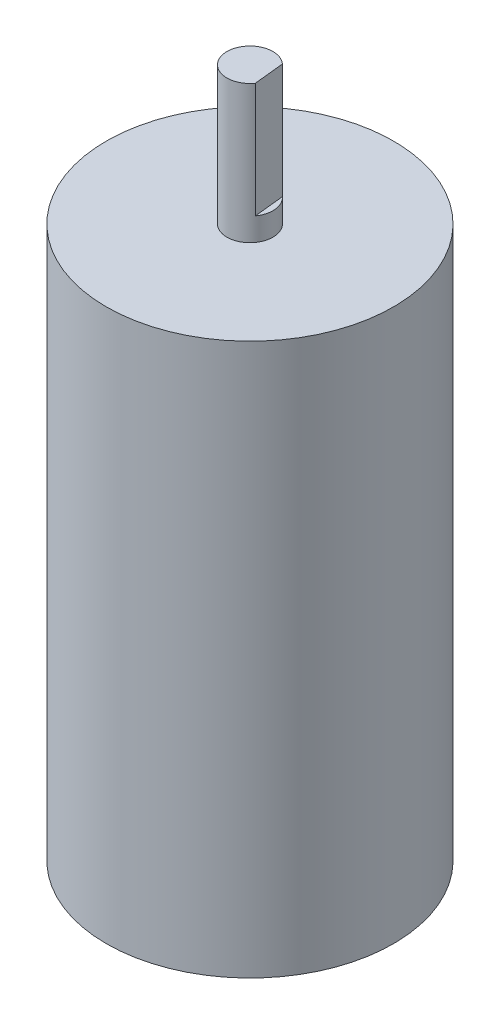
from build123d import *

# Parameters (mm, degrees)
SKETCH_1_R          = 12.5
EXTRUDE_1_DEPTH     = 48
SKETCH_2_R          = 2
EXTRUDE_2_DEPTH     = 12
CUT_EXTRUDE_START   = -10
CUT_EXTRUDE_1_DEPTH = 10


with BuildPart() as part:
    # 草图1 → 凸台-拉伸1 (new body)
    with BuildSketch(Plane(origin=(0, 0, 0), x_dir=(1, 0, 0), z_dir=(0, 1, 0))):
        with Locations(Location((0, 0, 0), (0, 0, 270))):
            Circle(SKETCH_1_R)
    extrude(amount=EXTRUDE_1_DEPTH)

    # 草图2 → 凸台-拉伸2 (add)
    with BuildSketch(Plane(origin=(0, 48, 0), x_dir=(1, 0, 0), z_dir=(0, 1, 0))):
        with Locations(Location((0, 0, 0), (0, 0, 270))):
            Circle(SKETCH_2_R)
    extrude(amount=EXTRUDE_2_DEPTH)

    # 草图3 → 切除-拉伸1 (cut)
    with BuildSketch(Plane(origin=(0, 60, 0), x_dir=(1, 0, 0), z_dir=(0, 1, 0)).offset(CUT_EXTRUDE_START)):
        with BuildLine():
            Line((1.62898558, -1.160347353), (1.354869647, 1.471165606))
            ThreePointArc((1.354869647, 1.471165606), (1.989236818, 0.207212169), (1.62898558, -1.160347353))
        make_face()
    extrude(amount=CUT_EXTRUDE_1_DEPTH, mode=Mode.SUBTRACT)


solid = part.part
